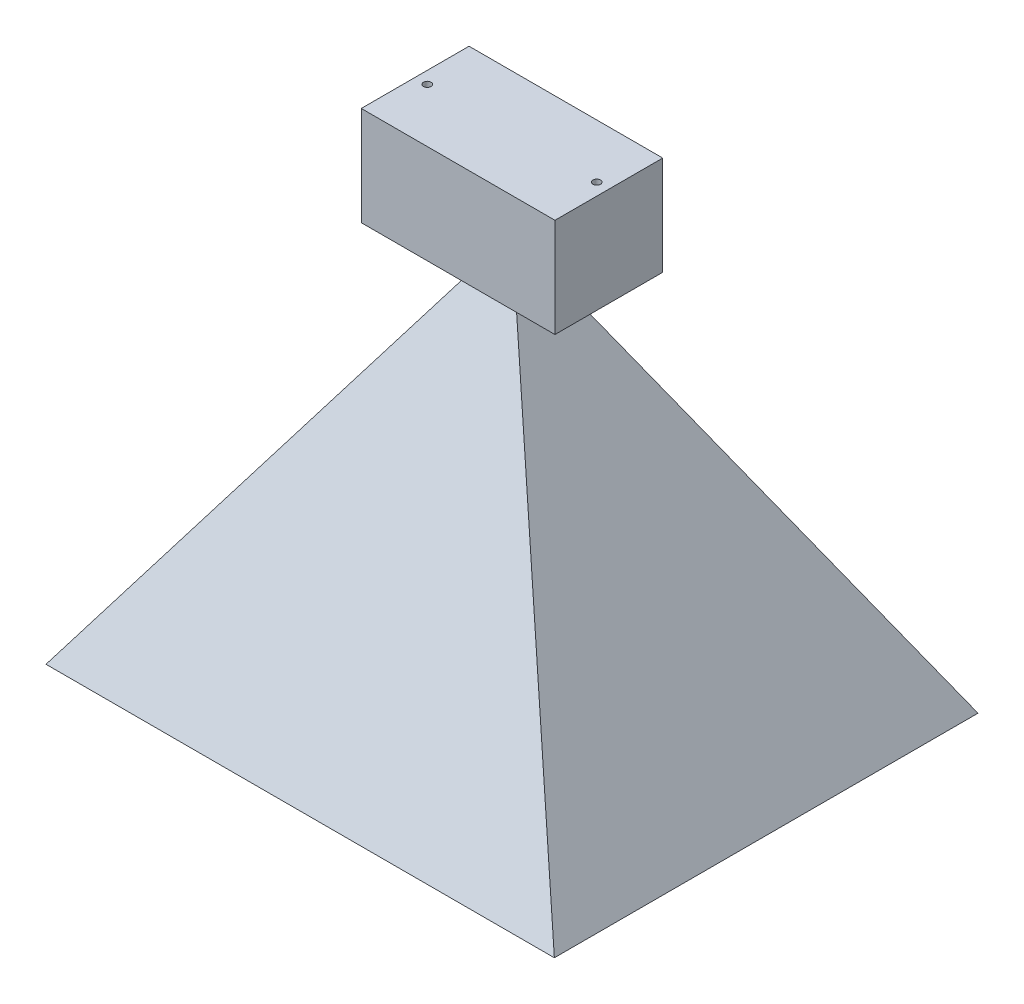
from build123d import *

# Parameters (mm, degrees)
SKETCH3_R                 = 8.509
CAMERA_LENS_DEPTH         = 0.254
SKETCH4_W                 = 58.0644
SKETCH4_H                 = 32.3088
CAMERA_HOLDER_DEPTH       = 29.6672
F_4_40_TAPPED_HOLE1_D     = 2.2606
F_4_40_TAPPED_HOLE1_DEPTH = 29.6672


with BuildPart() as part:
    # Sketch2 → FOV section 0
    with BuildSketch(Plane(origin=(0, 114.3, 0), x_dir=(1, 0, 0), z_dir=(0, 1, 0))):
        with BuildLine():
            Line((-2.473079913, -2.060899928), (2.473079913, -2.060899928))
            Line((2.473079913, -2.060899928), (2.473079913, 2.060899928))
            Line((2.473079913, 2.060899928), (-2.473079913, 2.060899928))
            Line((-2.473079913, 2.060899928), (-2.473079913, -2.060899928))
        make_face()
    # Sketch1 → FOV section 1
    with BuildSketch(Plane(origin=(0, 0, 0), x_dir=(1, 0, 0), z_dir=(0, 1, 0))):
        with BuildLine():
            Line((-76.2, -63.5), (76.2, -63.5))
            Line((76.2, -63.5), (76.2, 63.5))
            Line((76.2, 63.5), (-76.2, 63.5))
            Line((-76.2, 63.5), (-76.2, -63.5))
        make_face()
    loft()

    # Sketch3 → camera lens (add)
    with BuildSketch(Plane(origin=(0, 114.3, 0), x_dir=(1, 0, 0), z_dir=(0, 1, 0))):
        with Locations(Location((0, 0, 0), (0, 0, 270))):
            Circle(SKETCH3_R)
    extrude(amount=CAMERA_LENS_DEPTH)

    # Sketch4 → camera holder (add)
    with BuildSketch(Plane(origin=(0, 114.554, 0), x_dir=(1, 0, 0), z_dir=(0, 1, 0))):
        Rectangle(SKETCH4_W, SKETCH4_H)
    extrude(amount=CAMERA_HOLDER_DEPTH)

    # #4-40 Tapped Hole1
    with Locations(Plane(origin=(0, 144.2212, 0), x_dir=(1, 0, 0), z_dir=(0, 1, 0))):
        with Locations((-25.4, 0), (25.4, 0)):
            Hole(F_4_40_TAPPED_HOLE1_D / 2, depth=F_4_40_TAPPED_HOLE1_DEPTH)


solid = part.part
